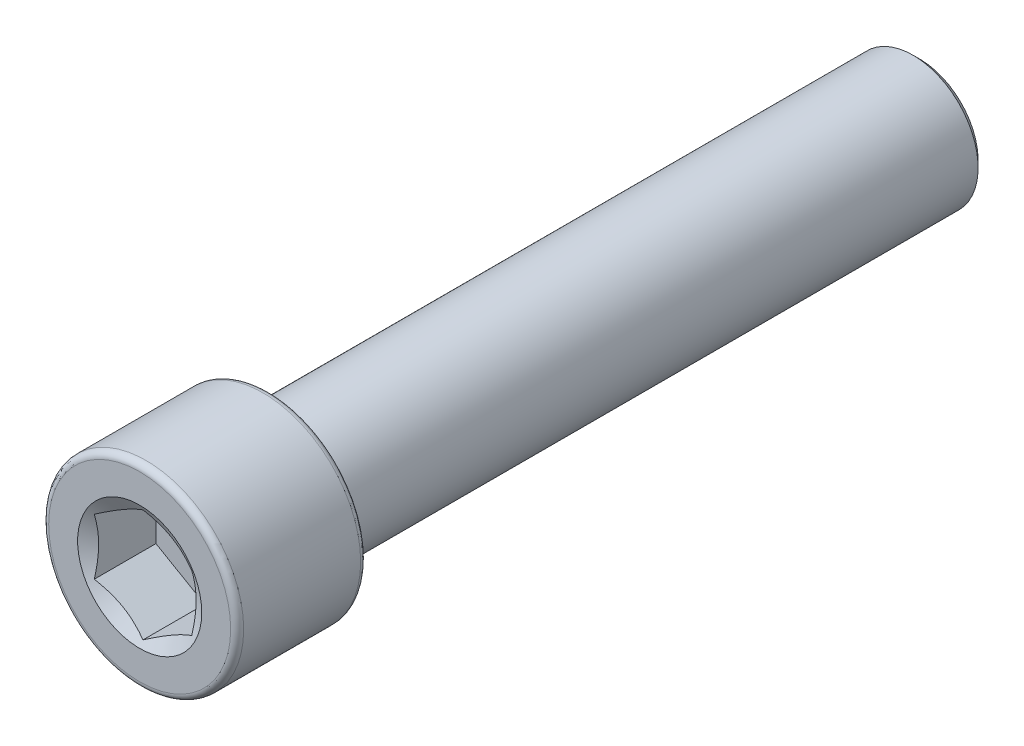
from build123d import *

# Parameters (mm, degrees)
CUT_EXTRUDE1_START = 19.05
CUT_EXTRUDE1_DEPTH = 3.175


with BuildPart() as part:
    # Sketch2 → Revolve1 (revolve)
    with BuildSketch(Plane(origin=(0, 0, 0), x_dir=(0, 0, -1), z_dir=(1, 0, 0)), mode=Mode.PRIVATE) as revolve1_sk:
        with BuildLine():
            Line((19.05, 0), (19.05, 2.8575))
            Line((19.05, 2.8575), (18.7325, 3.175))
            Line((18.7325, 3.175), (-12.7, 3.175))
            Line((-12.7, 3.175), (-12.7, 4.445))
            ThreePointArc((-12.7, 4.445), (-12.792993597, 4.669506403), (-13.0175, 4.7625))
            Line((-13.0175, 4.7625), (-18.7325, 4.7625))
            ThreePointArc((-18.7325, 4.7625), (-18.957006403, 4.669506403), (-19.05, 4.445))
            Line((-19.05, 4.445), (-19.05, 0))
            Line((-19.05, 0), (19.05, 0))
        make_face()
    revolve(revolve1_sk.sketch.rotate(Axis((0, 0, -19.05), (0, 0, 1)), 90), axis=Axis((0, 0, -19.05), (0, 0, 1)))

    # Sketch3 → Cut-Extrude1 (cut)
    with BuildSketch(Plane.XY.offset(CUT_EXTRUDE1_START)):
        Polygon((-2.38125, 1.374815329), (-2.38125, -1.374815329), (0, -2.749630657), (2.38125, -1.374815329), (2.38125, 1.374815329), (0, 2.749630657), align=None)
    extrude(amount=-CUT_EXTRUDE1_DEPTH, mode=Mode.SUBTRACT)

    # Cut-Extrude2 cone 1 section (through the dimple's axis) → Cut-Extrude2 (revolve, cut)
    with BuildSketch(Plane(origin=(0, 0, 19.05), x_dir=(0, -1, 0), z_dir=(1, 0, 0))):
        Polygon((0, 0), (3.032192214, 0), (0, 1.750636991), align=None)
    revolve(axis=Axis((0, 0, 19.05), (0, 0, -1)), mode=Mode.SUBTRACT)


solid = part.part
